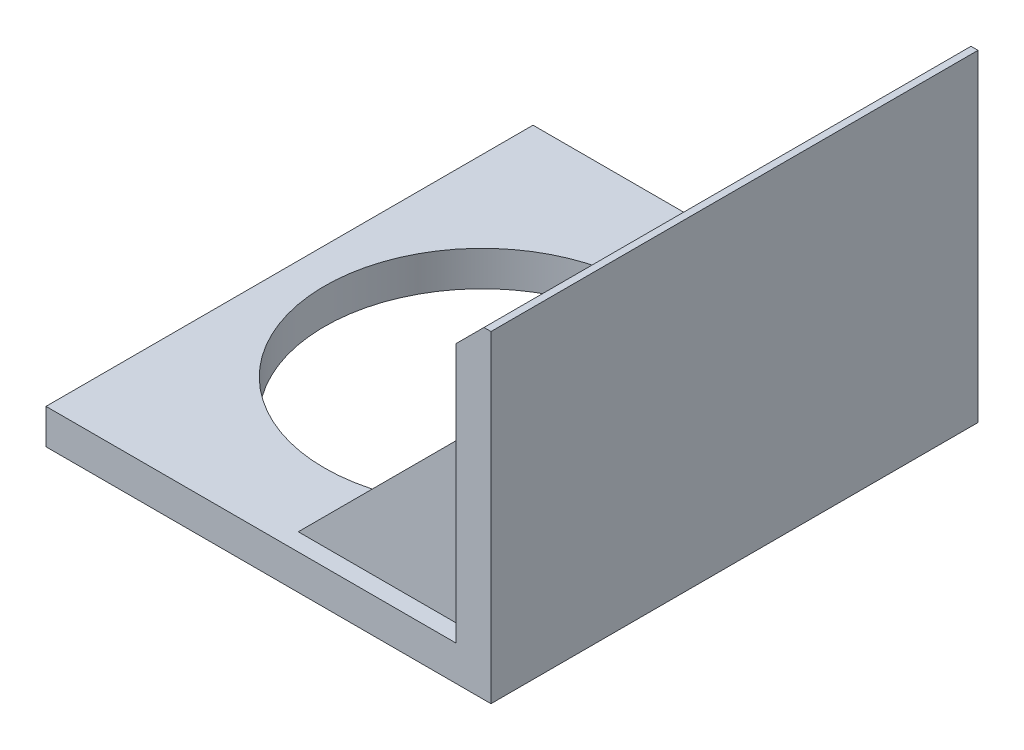
from build123d import *

# Parameters (mm, degrees)
SKETCH1_R       = 45
EXTRUDE1_DEPTH  = 10
SKETCH2_W       = 10
SKETCH2_H       = 139
EXTRUDE2_DEPTH  = 82
CHAMFER1_SIZE   = 8
EXTRUDE3_START  = -5
EXTRUDE3_DEPTH  = 8
LPATTERN1_COUNT = 2
LPATTERN1_PITCH = 121


with BuildPart() as part:
    # Sketch1 → Extrude1 (new body)
    with BuildSketch(Plane(origin=(0, 0, 0), x_dir=(1, 0, 0), z_dir=(0, 1, 0))):
        Polygon((0, 69.5), (-55, 69.5), (-55, -69.5), (0, -69.5), (72, -69.5), (72, 69.5), align=None)
        with Locations(Location((0, 0, 0), (0, 0, 270))):
            Circle(SKETCH1_R, mode=Mode.SUBTRACT)
    extrude(amount=EXTRUDE1_DEPTH)

    # Sketch2 → Extrude2 (add)
    with BuildSketch(Plane(origin=(0, 10, 0), x_dir=(1, 0, 0), z_dir=(0, 1, 0))):
        with Locations((67, 0)):
            Rectangle(SKETCH2_W, SKETCH2_H)
    extrude(amount=EXTRUDE2_DEPTH)

    # Chamfer1
    chamfer1_edges = [part.edges().sort_by_distance(p)[0] for p in [
        (62, 92, 0),
    ]]
    chamfer(chamfer1_edges, length=CHAMFER1_SIZE)

    # Sketch3 → Extrude3 (add)
    with BuildSketch(Plane.XY.offset(69.5).offset(EXTRUDE3_START)):
        Polygon((12, 10), (62, 10), (62, 60), align=None)
    extrude3 = extrude(amount=-EXTRUDE3_DEPTH)

    # LPattern1: Extrude3 ×2
    with Locations(*[(0, 0, -i * LPATTERN1_PITCH) for i in range(1, LPATTERN1_COUNT)]):
        add(extrude3)


solid = part.part
